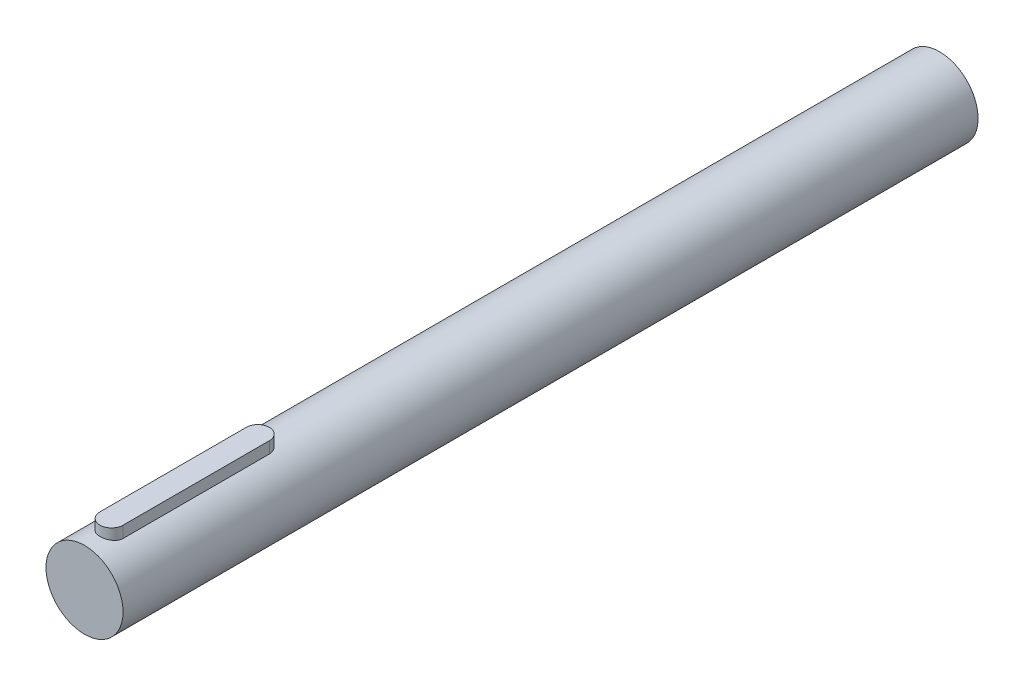
from build123d import *

# Parameters (mm, degrees)
SKETCH_1_R           = 5
EXTRUDE_1_DEPTH      = 26
EXTRUDE_START        = 85
SKETCH_3_R           = 5
EXTRUDE_3_DEPTH      = 85
EXTRUDE_4_REACH      = 87.889
EXTRUDE_4_END_RADIUS = 5


with BuildPart() as part:
    # 草图1 → 凸台-拉伸1 (new body)
    with BuildSketch(Plane.XY):
        with Locations(Location((0, 0, 0), (0, 0, 180))):
            Circle(SKETCH_1_R)
    extrude(amount=EXTRUDE_1_DEPTH)

    # 草图3 → 凸台-拉伸3 (add)
    with BuildSketch(Plane(origin=(0, 0, 0), x_dir=(-1, 0, 0), z_dir=(0, 0, -1)).offset(EXTRUDE_START)):
        Circle(SKETCH_3_R)
    extrude(amount=-EXTRUDE_3_DEPTH)

    # 凸台-拉伸4: up to this cylinder (the profile starts outside it)
    extrude_4_end = Plane(origin=(0, 0, 13), z_dir=(0, 0, -1)) * Cylinder(EXTRUDE_4_END_RADIUS, 186.778, mode=Mode.PRIVATE)
    # 草图5 → 凸台-拉伸4 (add, up to the surface)
    with BuildSketch(Plane(origin=(0, 6.269, 0), x_dir=(1, 0, 0), z_dir=(0, 1, 0)), mode=Mode.PRIVATE) as extrude_4_sk1:
        with BuildLine():
            Line((1.5, -3.5), (1.5, -22.5))
            ThreePointArc((1.5, -22.5), (0, -24), (-1.5, -22.5))
            Line((-1.5, -22.5), (-1.5, -3.5))
            ThreePointArc((-1.5, -3.5), (0, -2), (1.5, -3.5))
        make_face()
    extrude_4_tool1 = extrude(extrude_4_sk1.sketch, amount=-EXTRUDE_4_REACH, mode=Mode.PRIVATE) - extrude_4_end
    add(extrude_4_tool1.solids().sort_by_distance((0, 6.269, 13))[0])


solid = part.part
